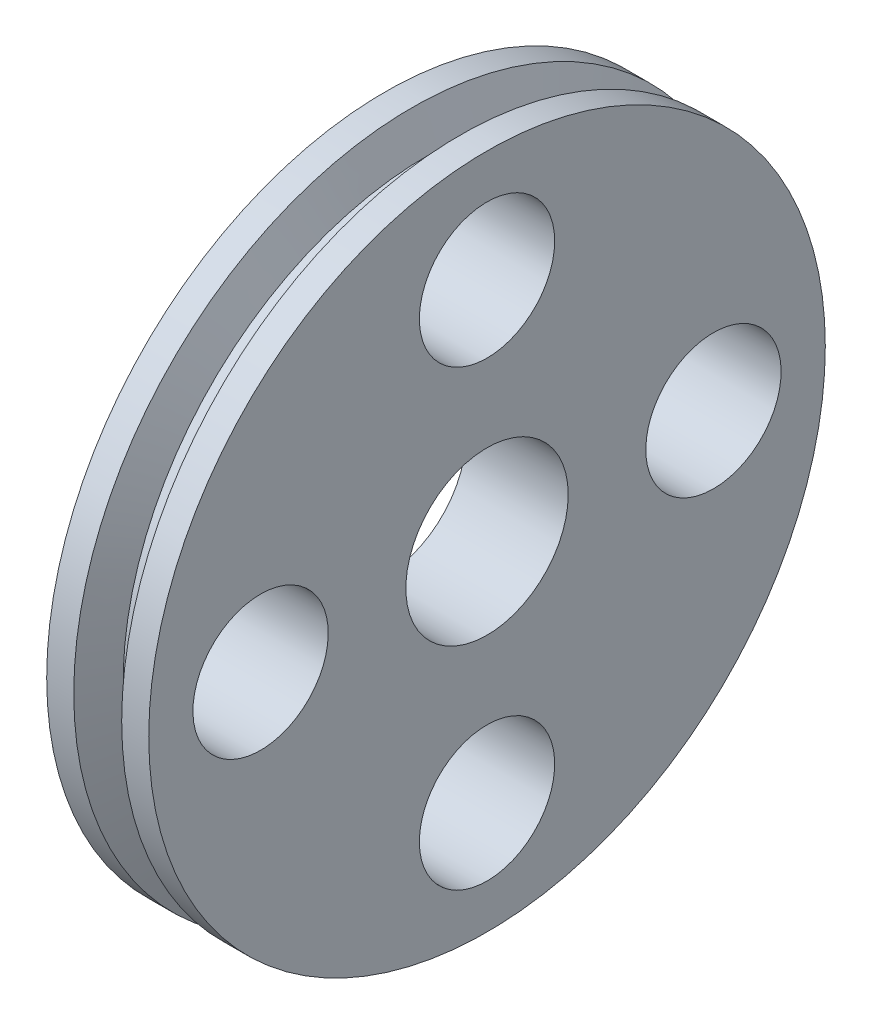
from build123d import *

# Parameters (mm, degrees)
SKETCH2_R          = 20
CUT_EXTRUDE1_DEPTH = 103
CIRPATTERN1_COUNT  = 4


with BuildPart() as part:
    # Sketch1 → Revolve1 (revolve)
    with BuildSketch(Plane.XY, mode=Mode.PRIVATE) as revolve1_sk:
        Polygon((-20.854858804, 24), (-51.021525471, 24), (-51.021525471, 100), (-43.021525471, 100), (-38.438192137, 90), (-33.438192137, 90), (-28.854858804, 100), (-20.854858804, 100), align=None)
    revolve(revolve1_sk.sketch.rotate(Axis((0, 0, 0), (-1, 0, 0)), 90), axis=Axis((0, 0, 0), (-1, 0, 0)))

    # Sketch2 → Cut-Extrude1 (cut)
    with BuildSketch(Plane(origin=(-20.854858804, 0, 0), x_dir=(0, 0, -1), z_dir=(1, 0, 0))):
        with Locations((0, 66.936858639)):
            Circle(SKETCH2_R)
    cut_extrude1 = extrude(amount=-CUT_EXTRUDE1_DEPTH, mode=Mode.SUBTRACT)

    # CirPattern1: Cut-Extrude1 ×4 about axis
    cirpattern1_axis = Axis((0, 0, 0), (1, 0, 0))
    for i in range(1, CIRPATTERN1_COUNT):
        add(cut_extrude1.rotate(cirpattern1_axis, i * 360 / CIRPATTERN1_COUNT), mode=Mode.SUBTRACT)


solid = part.part
